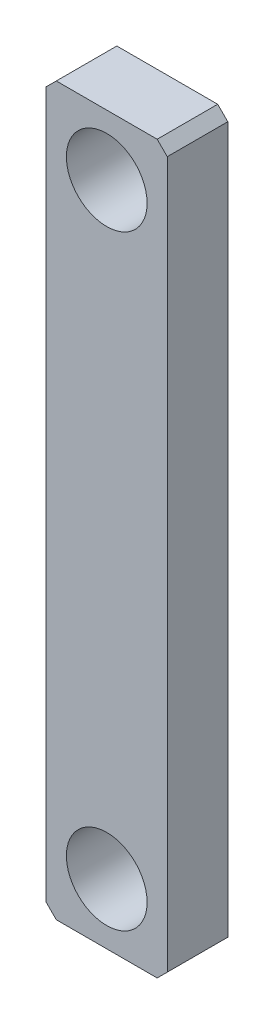
from build123d import *

# Parameters (mm, degrees)
SKETCH_4_W               = 12
SKETCH_4_H               = 72
EXTRUDE_1_DEPTH          = 6
CUT_EXTRUDE_1_DEPTH      = 37.986484018
CUT_EXTRUDE_1_DEPTH_BACK = 37.986484018
SKETCH_5_R               = 4
CHAMFER_1_SIZE           = 1


with BuildPart() as part:
    # ｽｹｯﾁ4 → ﾎﾞｽ - 押し出し1 (new body)
    with BuildSketch(Plane.XY):
        Rectangle(SKETCH_4_W, SKETCH_4_H)
    extrude(amount=EXTRUDE_1_DEPTH)

    # ｽｹｯﾁ5 → ｶｯﾄ - 押し出し1 (cut, two sides: drawn at the far end of the back side and taken through both)
    with BuildSketch(Plane.XY.offset(6).offset(-CUT_EXTRUDE_1_DEPTH_BACK)):
        with Locations((0, 30)):
            Circle(SKETCH_5_R)
        with Locations((0, -30)):
            Circle(SKETCH_5_R)
    extrude(amount=CUT_EXTRUDE_1_DEPTH + CUT_EXTRUDE_1_DEPTH_BACK, mode=Mode.SUBTRACT)

    # 面取り1
    chamfer_1_edges = [part.edges().sort_by_distance(p)[0] for p in [
        (6, -36, 3),
        (-6, -36, 3),
        (-6, 36, 3),
        (6, 36, 3),
    ]]
    chamfer(chamfer_1_edges, length=CHAMFER_1_SIZE)


solid = part.part
